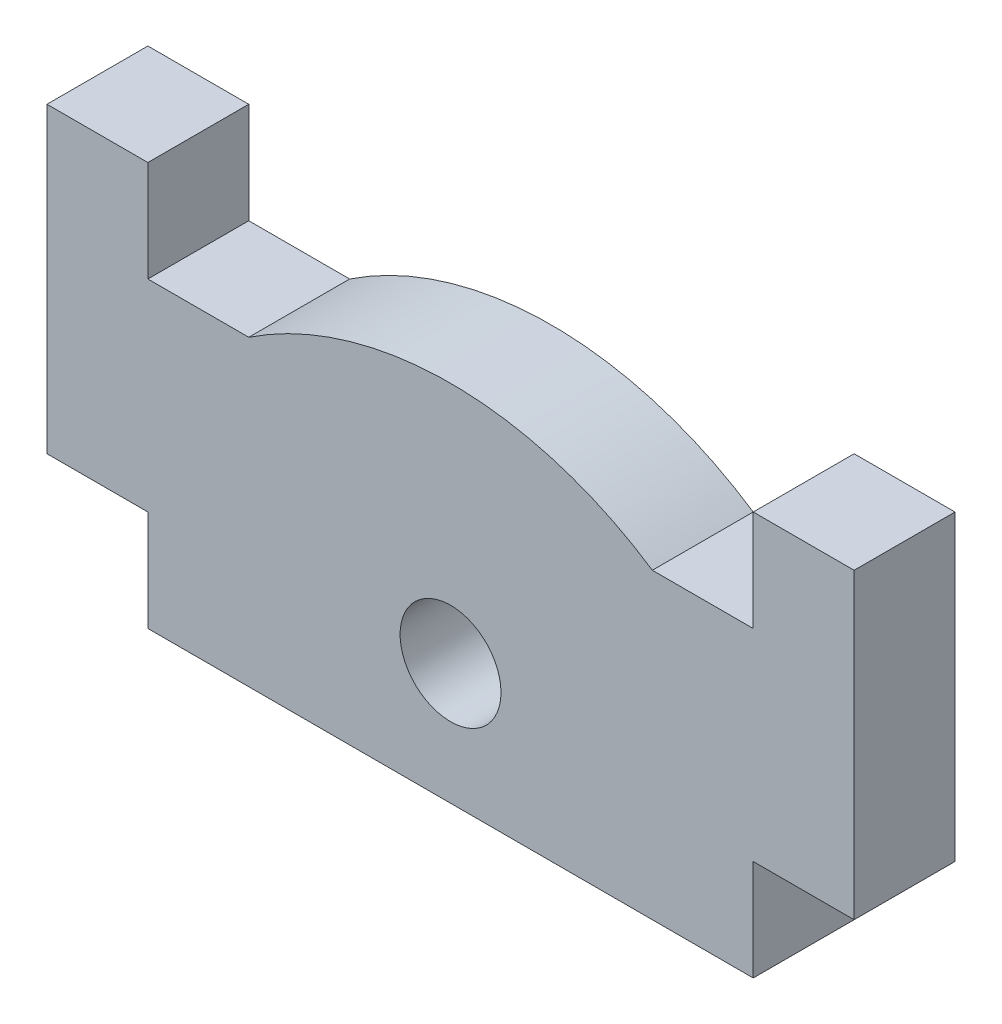
from build123d import *

# Parameters (mm, degrees)
SKETCH1_R           = 1
BOSS_EXTRUDE1_DEPTH = 2


with BuildPart() as part:
    # Sketch1 → Boss-Extrude1 (new body)
    with BuildSketch(Plane.XY):
        with BuildLine():
            Line((4, 6), (6, 6))
            Line((6, 6), (6, 8))
            Line((6, 8), (8, 8))
            Line((8, 8), (8, 2))
            Line((8, 2), (6, 2))
            Line((6, 2), (6, 0))
            Line((6, 0), (-6, 0))
            Line((-6, 0), (-6, 2))
            Line((-6, 2), (-8, 2))
            Line((-8, 2), (-8, 8))
            Line((-8, 8), (-6, 8))
            Line((-6, 8), (-6, 6))
            Line((-6, 6), (-4, 6))
            ThreePointArc((-4, 6), (0, 7.211102551), (4, 6))
        make_face()
        with Locations((0, 2.4)):
            Circle(SKETCH1_R, mode=Mode.SUBTRACT)
    extrude(amount=BOSS_EXTRUDE1_DEPTH)


solid = part.part
